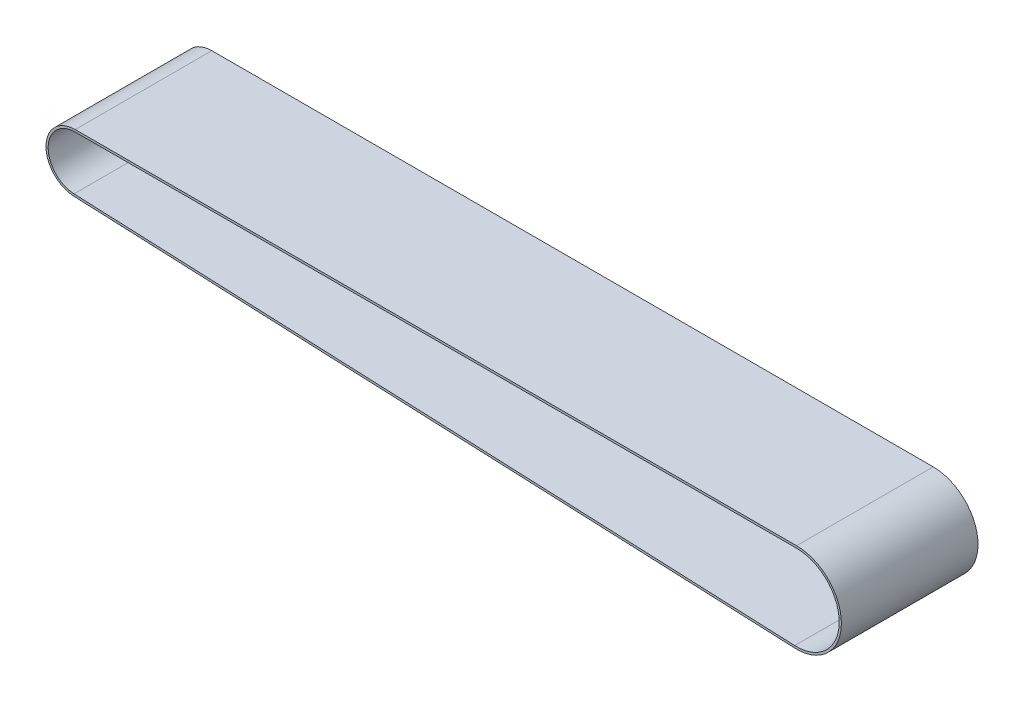
from build123d import *

# Parameters (mm, degrees)
LINEAR_AUSTRAGEN_D_NN1_DEPTH = 62.5


with BuildPart() as part:
    # Skizze2 → Linear-Austragen-Dünn1 (new, symmetric)
    with BuildSketch(Plane.XY):
        with BuildLine():
            Line((658.245872085, -54.962458853), (-1.144461538, -26.72550669))
            ThreePointArc((-1.144461538, -26.72550669), (-26.743983927, 0.567296628), (-0.010132649, 26.749998081))
            Line((-0.010132649, 26.749998081), (659.984469635, 26.999997059))
            ThreePointArc((659.984469635, 26.999997059), (700.990779053, -14.869501374), (658.245872085, -54.962458853))
        make_face()
        with BuildLine():
            Line((658.3314393, -52.964290128), (-1.058894323, -24.727337966))
            ThreePointArc((-1.058894323, -24.727337966), (-24.744433729, 0.524881927), (-0.00937507, 24.749998224))
            Line((-0.00937507, 24.749998224), (659.985227213, 24.999997202))
            ThreePointArc((659.985227213, 24.999997202), (698.991228855, -14.827086673), (658.3314393, -52.964290128))
        make_face(mode=Mode.SUBTRACT)
    extrude(amount=LINEAR_AUSTRAGEN_D_NN1_DEPTH, both=True)


solid = part.part
